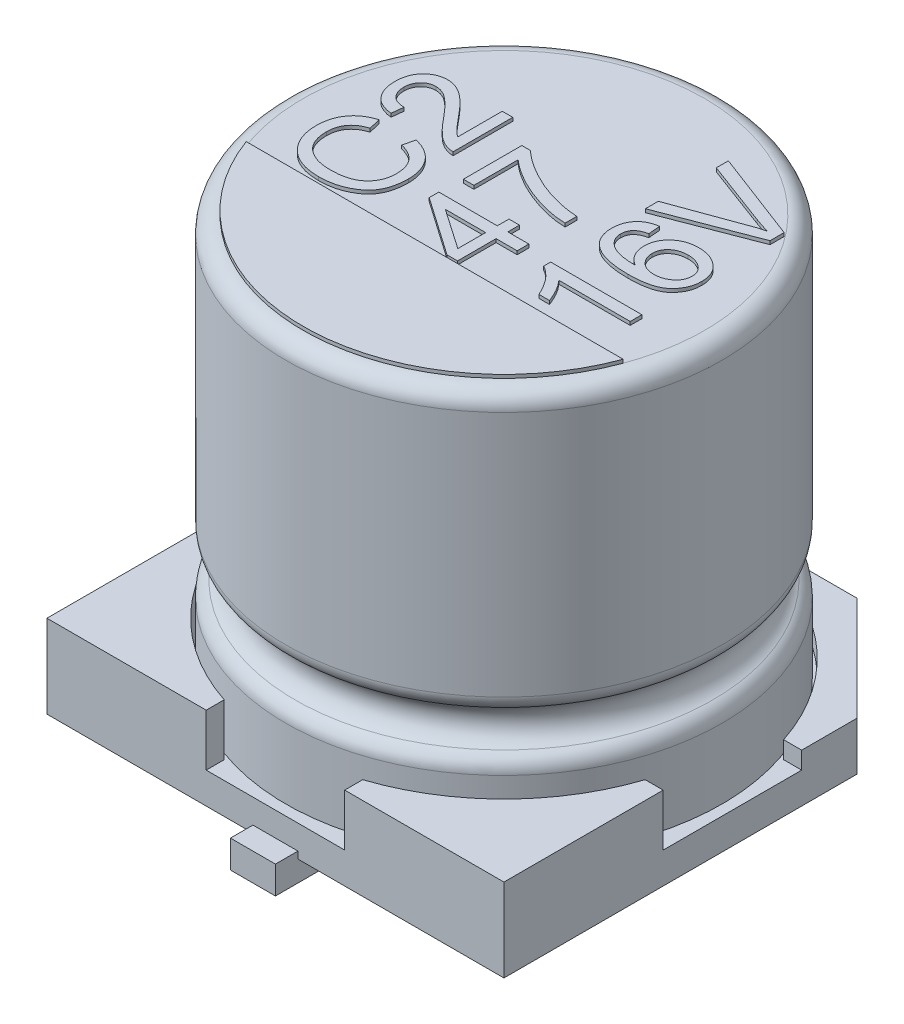
from build123d import *

# Parameters (mm, degrees)
ESQUISSE1_W               = 6.6
ESQUISSE1_H               = 6.6
BOSS_EXTRU_1_DEPTH        = 1.2
ESQUISSE2_R               = 3.2
ESQUISSE2_W               = 6.6
ESQUISSE2_H               = 2
ESQUISSE2_W_2             = 2
ESQUISSE2_H_2             = 6.6
ENL_V_MAT_EXTRU_1_DEPTH   = 0.75
ESQUISSE3_W               = 6.6
ESQUISSE3_H               = 3.3
ENL_V_MAT_EXTRU_2_DEPTH   = 0.5
CHANFREIN1_SIZE           = 1.5
BOSS_EXTRU_2_DEPTH        = 0.3
BOSS_EXTRU_2_DEPTH_BACK   = 0.1
ESQUISSE5_W               = 0.65
ESQUISSE5_H               = 0.65
BOSS_EXTRU_2_2_DEPTH      = 0.3
BOSS_EXTRU_2_2_DEPTH_BACK = 0.1
ESQUISSE6_R               = 0.5
BOSS_EXTRU_3_DEPTH        = 0.3
BOSS_EXTRU_4_DEPTH        = 0.05
BOSS_EXTRU_4_2_DEPTH      = 0.05
BOSS_EXTRU_4_3_DEPTH      = 0.05
BOSS_EXTRU_4_4_DEPTH      = 0.05
BOSS_EXTRU_4_5_DEPTH      = 0.05
BOSS_EXTRU_4_6_DEPTH      = 0.05
BOSS_EXTRU_4_7_DEPTH      = 0.05
BOSS_EXTRU_4_8_DEPTH      = 0.05


with BuildPart() as part:
    # Esquisse1 → Boss.-Extru.1 (new body)
    with BuildSketch(Plane(origin=(0, 0, 0), x_dir=(1, 0, 0), z_dir=(0, 1, 0))):
        Rectangle(ESQUISSE1_W, ESQUISSE1_H)
    extrude(amount=BOSS_EXTRU_1_DEPTH)

    # Esquisse2 → Enlèv. mat.-Extru.1 (cut)
    with BuildSketch(Plane(origin=(0, 1.2, 0), x_dir=(1, 0, 0), z_dir=(0, 1, 0))):
        Circle(ESQUISSE2_R)
        Rectangle(ESQUISSE2_W, ESQUISSE2_H)
        Rectangle(ESQUISSE2_W_2, ESQUISSE2_H_2)
    extrude(amount=-ENL_V_MAT_EXTRU_1_DEPTH, mode=Mode.SUBTRACT)

    # Esquisse3 → Enlèv. mat.-Extru.2 (cut)
    with BuildSketch(Plane(origin=(0, 1.2, 0), x_dir=(1, 0, 0), z_dir=(0, 1, 0))):
        with Locations((0, 1.65)):
            Rectangle(ESQUISSE3_W, ESQUISSE3_H)
    extrude(amount=-ENL_V_MAT_EXTRU_2_DEPTH, mode=Mode.SUBTRACT)

    # Chanfrein1
    chanfrein1_edges = [part.edges().sort_by_distance(p)[0] for p in [
        (3.3, 0.35, -3.3),
        (-3.3, 0.35, -3.3),
    ]]
    chamfer(chanfrein1_edges, length=CHANFREIN1_SIZE)

    # Esquisse6 → Boss.-Extru.3 (add)
    with BuildSketch(Plane.XZ):
        with Locations(Location((-2, 2, 0), (0, 0, 270))):
            Circle(ESQUISSE6_R)
        with Locations(Location((2, 2, 0), (0, 0, 270))):
            Circle(ESQUISSE6_R)
        with Locations(Location((2, -2, 0), (0, 0, 270))):
            Circle(ESQUISSE6_R)
        with Locations(Location((-2, -2, 0), (0, 0, 270))):
            Circle(ESQUISSE6_R)
    extrude(amount=BOSS_EXTRU_3_DEPTH)


with BuildPart() as body_2:
    # Esquisse4 → Révolution1 (revolve)
    with BuildSketch(Plane(origin=(0, 0, 0), x_dir=(0, 0, -1), z_dir=(1, 0, 0)), mode=Mode.PRIVATE) as r_volution1_sk:
        with BuildLine():
            Line((0, 6.25), (-2.9, 6.25))
            ThreePointArc((-2.9, 6.25), (-3.076776695, 6.176776695), (-3.15, 6))
            Line((-3.15, 6), (-3.15, 2.439897949))
            ThreePointArc((-3.15, 2.439897949), (-3.113200716, 2.309339707), (-3.013636364, 2.217217063))
            ThreePointArc((-3.013636364, 2.217217063), (-2.85, 1.95), (-3.013636364, 1.682782937))
            ThreePointArc((-3.013636364, 1.682782937), (-3.113200716, 1.590660293), (-3.15, 1.460102051))
            Line((-3.15, 1.460102051), (-3.15, 0.45))
            Line((-3.15, 0.45), (0, 0.45))
            Line((0, 0.45), (0, 6.25))
        make_face()
    revolve(r_volution1_sk.sketch.rotate(Axis((0, 0.45, 0), (0, 1, 0)), 180), axis=Axis((0, 0.45, 0), (0, 1, 0)))


with BuildPart() as body_3:
    # Esquisse5 → Boss.-Extru.2 (new, two sides: drawn at the far end of the back side and taken through both)
    with BuildSketch(Plane.XZ.offset(-BOSS_EXTRU_2_DEPTH_BACK)):
        with Locations((0, 3.3)):
            Rectangle(ESQUISSE5_W, ESQUISSE5_H)
    extrude(amount=BOSS_EXTRU_2_DEPTH + BOSS_EXTRU_2_DEPTH_BACK)


with BuildPart() as body_4:
    # Esquisse5 → Boss.-Extru.2 2 (new, two sides: drawn at the far end of the back side and taken through both)
    with BuildSketch(Plane.XZ.offset(-BOSS_EXTRU_2_2_DEPTH_BACK)):
        with Locations((0, -3.3)):
            Rectangle(ESQUISSE5_W, ESQUISSE5_H)
    extrude(amount=BOSS_EXTRU_2_2_DEPTH + BOSS_EXTRU_2_2_DEPTH_BACK)


with BuildPart() as body_5:
    # Esquisse7 → Boss.-Extru.4 (new body)
    with BuildSketch(Plane(origin=(0, 6.25, 0), x_dir=(1, 0, 0), z_dir=(0, 1, 0))):
        with BuildLine():
            Line((-2.722131518, -1), (2.722131518, -1))
            ThreePointArc((2.722131518, -1), (0, -2.9), (-2.722131518, -1))
        make_face()
    extrude(amount=BOSS_EXTRU_4_DEPTH)


with BuildPart() as body_6:
    # Esquisse7 → Boss.-Extru.4 2 (new body)
    with BuildSketch(Plane(origin=(0, 6.25, 0), x_dir=(1, 0, 0), z_dir=(0, 1, 0))):
        Polygon((0.296103896, -0.071428571), (0.296103896, -0.24025974), (0.6, -0.24025974), (0.6, -0.409090909), (0.296103896, -0.409090909), (0.296103896, -0.966233766), (0.144155844, -0.966233766), (-0.7, -0.379017857), (-0.7, -0.24025974), (0.144155844, -0.24025974), (0.144155844, -0.071428571), align=None)
        Polygon((0.144155844, -0.409090909), (-0.432508117, -0.409090909), (-0.432508117, -0.412520292), (0.144155844, -0.810064935), align=None, mode=Mode.SUBTRACT)
    extrude(amount=BOSS_EXTRU_4_2_DEPTH)


with BuildPart() as body_7:
    # Esquisse7 → Boss.-Extru.4 3 (new body)
    with BuildSketch(Plane(origin=(0, 6.25, 0), x_dir=(1, 0, 0), z_dir=(0, 1, 0))):
        with BuildLine():
            add(Edge.make_bspline(
                [(-0.561769481, 0.941558442), (-0.543990179, 0.925717685), (-0.508027109, 0.893675804), (-0.450586487, 0.848641711), (-0.3904709, 0.80453927), (-0.326676072, 0.762899908), (-0.260252054, 0.721970855), (-0.19025817, 0.683445144), (-0.117295293, 0.646115762), (-0.041643658, 0.610664543), (0.036098502, 0.578196899), (0.11472146, 0.548637502), (0.194253592, 0.523543832), (0.274149315, 0.50138235), (0.354781461, 0.483647136), (0.435863592, 0.46891175), (0.517682436, 0.458379626), (0.572543391, 0.454093271), (0.6, 0.451948052)],
                knots=[0, 0, 0, 0, 0.890443169, 1.8011434, 2.72871408, 3.67830878, 4.649628621, 5.64630914, 6.665648346, 7.714738694, 8.77023317, 9.816117091, 10.855215011, 11.888472104, 12.916223604, 13.941999776, 14.970019627, 16, 16, 16, 16], degree=3))
            Line((0.6, 0.451948052), (0.6, 0.283116883))
            add(Edge.make_bspline(
                [(0.6, 0.283116883), (0.577563575, 0.284043261), (0.531991638, 0.285924881), (0.462851153, 0.292875252), (0.392095355, 0.303794478), (0.319788097, 0.318428905), (0.245841613, 0.336366822), (0.170220452, 0.35803723), (0.093079903, 0.383812161), (0.014824341, 0.412421512), (-0.06269314, 0.44439909), (-0.138070487, 0.478962459), (-0.210847697, 0.515514293), (-0.280520376, 0.554995133), (-0.34760432, 0.59655633), (-0.411639883, 0.640745749), (-0.473239776, 0.686727654), (-0.51191236, 0.719836812), (-0.531168831, 0.736323052)],
                knots=[0, 0, 0, 0, 0.869045849, 1.765169938, 2.687948117, 3.639137891, 4.619848113, 5.632498604, 6.682982998, 7.767344363, 8.85702895, 9.927714978, 10.976477627, 12.008263417, 13.026390201, 14.029951021, 15.01904175, 16, 16, 16, 16], degree=3))
            Line((-0.531168831, 0.736323052), (-0.531168831, 0.097402597))
            Line((-0.531168831, 0.097402597), (-0.683116883, 0.097402597))
            Line((-0.683116883, 0.097402597), (-0.683116883, 0.941558442))
            Line((-0.683116883, 0.941558442), (-0.561769481, 0.941558442))
        make_face()
    extrude(amount=BOSS_EXTRU_4_3_DEPTH)


with BuildPart() as body_8:
    # Esquisse7 → Boss.-Extru.4 4 (new body)
    with BuildSketch(Plane(origin=(0, 6.25, 0), x_dir=(1, 0, 0), z_dir=(0, 1, 0))):
        with BuildLine():
            Line((2.3, -0.307792208), (2.3, -0.476623377))
            Line((2.3, -0.476623377), (1.27012987, -0.476623377))
            add(Edge.make_bspline(
                [(1.27012987, -0.476623377), (1.279223462, -0.486984406), (1.297670325, -0.508002338), (1.323418107, -0.541939461), (1.348324339, -0.578158837), (1.372037178, -0.617024985), (1.39472956, -0.658496452), (1.416257396, -0.702559652), (1.436916947, -0.748996188), (1.449463122, -0.781083079), (1.455844156, -0.797402597)],
                knots=[0, 0, 0, 0, 0.887204464, 1.799744156, 2.740245044, 3.715929421, 4.729246756, 5.78238396, 6.872111789, 8, 8, 8, 8], degree=3))
            Line((1.455844156, -0.797402597), (1.303896104, -0.797402597))
            add(Edge.make_bspline(
                [(1.303896104, -0.797402597), (1.293102344, -0.774483614), (1.272072929, -0.729830701), (1.236626461, -0.66705158), (1.199399203, -0.609831301), (1.16045468, -0.558087831), (1.119141498, -0.512270563), (1.076102522, -0.471980489), (1.031133268, -0.437074324), (0.998988334, -0.418340614), (0.983116883, -0.409090909)],
                knots=[0, 0, 0, 0, 1.186218497, 2.3111021, 3.37345738, 4.381680583, 5.341076965, 6.258983301, 7.14037897, 8, 8, 8, 8], degree=3))
            Line((0.983116883, -0.409090909), (0.983116883, -0.307792208))
            Line((0.983116883, -0.307792208), (2.3, -0.307792208))
        make_face()
    extrude(amount=BOSS_EXTRU_4_4_DEPTH)


with BuildPart() as body_9:
    # Esquisse7 → Boss.-Extru.4 5 (new body)
    with BuildSketch(Plane(origin=(0, 6.25, 0), x_dir=(1, 0, 0), z_dir=(0, 1, 0))):
        with BuildLine():
            add(Edge.make_bspline(
                [(1.627049513, 0.266233766), (1.613450204, 0.275238165), (1.586906324, 0.292813447), (1.551847818, 0.323932831), (1.52224805, 0.358062815), (1.497757448, 0.394853213), (1.478733011, 0.434622693), (1.465738061, 0.47733157), (1.457178022, 0.522656734), (1.456294986, 0.5539099), (1.455844156, 0.569866071)],
                knots=[0, 0, 0, 0, 1.069954415, 2.088395883, 3.066632478, 4.029065089, 4.982046927, 5.949919737, 6.953340264, 8, 8, 8, 8], degree=3))
            add(Edge.make_bspline(
                [(1.455844156, 0.569866071), (1.456191805, 0.582548179), (1.456878439, 0.607596362), (1.462545816, 0.64439928), (1.471850024, 0.679631672), (1.484485531, 0.713546338), (1.501385133, 0.7457272), (1.521383712, 0.776893214), (1.545647627, 0.806087597), (1.57293232, 0.833726618), (1.603149516, 0.858887064), (1.63558394, 0.88126992), (1.670435777, 0.899630894), (1.70699582, 0.915123616), (1.745722852, 0.927004517), (1.786547903, 0.935275404), (1.829318218, 0.940838077), (1.858558723, 0.941315506), (1.8734375, 0.941558442)],
                knots=[0, 0, 0, 0, 0.975125205, 1.925950693, 2.856152245, 3.774449697, 4.70315003, 5.646803566, 6.617626571, 7.617215937, 8.630442275, 9.637872749, 10.642483832, 11.65496491, 12.688309326, 13.752171127, 14.856211817, 16, 16, 16, 16], degree=3))
            add(Edge.make_bspline(
                [(1.8734375, 0.941558442), (1.888580343, 0.941317494), (1.918347182, 0.940843855), (1.961983437, 0.935238168), (2.004065218, 0.926985596), (2.04426656, 0.91475994), (2.082960891, 0.899469991), (2.119576045, 0.880323032), (2.154744008, 0.858075663), (2.187621145, 0.832380443), (2.218017881, 0.804115367), (2.244524958, 0.773169631), (2.26683893, 0.739924589), (2.285202716, 0.704550145), (2.299579764, 0.666870265), (2.309430036, 0.626812278), (2.315698497, 0.584571905), (2.316482257, 0.55564374), (2.316883117, 0.540848214)],
                knots=[0, 0, 0, 0, 1.085548404, 2.133902048, 3.150719742, 4.158438961, 5.143478499, 6.130857801, 7.117733313, 8.124563847, 9.119649328, 10.090449915, 11.040371519, 11.985443394, 12.943683995, 13.925811242, 14.939140701, 16, 16, 16, 16], degree=3))
            add(Edge.make_bspline(
                [(2.316883117, 0.540848214), (2.316485003, 0.525789733), (2.315699126, 0.496064278), (2.30922735, 0.45227623), (2.298467941, 0.410260062), (2.283175096, 0.369999989), (2.263930883, 0.331398768), (2.240229667, 0.294431855), (2.212090634, 0.25937232), (2.185526962, 0.231697854), (2.16173043, 0.210909807), (2.141984459, 0.196313685), (2.12071524, 0.182321071), (2.097548676, 0.169925454), (2.072879154, 0.158124335), (2.046428775, 0.147771295), (2.018546469, 0.137838126), (1.988771702, 0.129565645), (1.957480451, 0.121857064), (1.924464164, 0.115322522), (1.889799343, 0.10974132), (1.853435335, 0.105427189), (1.815463748, 0.101534382), (1.775761166, 0.099407309), (1.734430917, 0.09766443), (1.70627918, 0.09749094), (1.691943994, 0.097402597)],
                knots=[0, 0, 0, 0, 1.247779403, 2.463117631, 3.659976664, 4.836419457, 6.026221779, 7.229279442, 8.468942427, 9.747322861, 10.403533791, 11.085784176, 11.78126166, 12.511907243, 13.26182283, 14.046870347, 14.865219006, 15.714252586, 16.607026578, 17.536193268, 18.503241106, 19.516724355, 20.571286828, 21.666600567, 22.811806305, 24, 24, 24, 24], degree=3))
            add(Edge.make_bspline(
                [(1.691943994, 0.097402597), (1.66405944, 0.097732004), (1.610078492, 0.098369693), (1.53179155, 0.103971256), (1.45884114, 0.113044828), (1.391205321, 0.125820084), (1.328908012, 0.142369357), (1.271919877, 0.16260206), (1.220163171, 0.186578768), (1.173754642, 0.214256842), (1.132735067, 0.245565842), (1.097145189, 0.280237509), (1.066919268, 0.318271077), (1.042563218, 0.359827163), (1.02338332, 0.404577389), (1.009730122, 0.452607049), (1.001342979, 0.503973819), (1.000455589, 0.53932045), (1, 0.557467532)],
                knots=[0, 0, 0, 0, 1.424582619, 2.757810733, 4.007769843, 5.178820556, 6.271924257, 7.297969076, 8.264779121, 9.181696118, 10.053356541, 10.895296698, 11.714155951, 12.52784682, 13.349044585, 14.195146158, 15.073381762, 16, 16, 16, 16], degree=3))
            add(Edge.make_bspline(
                [(1, 0.557467532), (1.000266189, 0.569347725), (1.000788053, 0.592638937), (1.004513002, 0.626879674), (1.010823326, 0.659713581), (1.019796421, 0.691242231), (1.031438305, 0.721314076), (1.045468679, 0.750058478), (1.062151749, 0.777202626), (1.081137312, 0.802951217), (1.10276139, 0.826674161), (1.1269229, 0.848246212), (1.153717516, 0.867207906), (1.182816476, 0.883930992), (1.2145108, 0.897931697), (1.248615786, 0.909424797), (1.285095392, 0.918837371), (1.310447816, 0.922699565), (1.323417208, 0.924675325)],
                knots=[0, 0, 0, 0, 1.05367056, 2.065729412, 3.050830916, 4.016126385, 4.969213069, 5.907536784, 6.849258065, 7.791463712, 8.741097404, 9.691307467, 10.658743283, 11.647450802, 12.663499054, 13.726567437, 14.836993312, 16, 16, 16, 16], degree=3))
            Line((1.323417208, 0.924675325), (1.337662338, 0.755844156))
            add(Edge.make_bspline(
                [(1.337662338, 0.755844156), (1.321728395, 0.75208586), (1.291447841, 0.744943667), (1.249723652, 0.728902171), (1.214342308, 0.708544848), (1.185174599, 0.684021814), (1.162541528, 0.655279008), (1.14637255, 0.622526032), (1.136698364, 0.585712537), (1.135622605, 0.559813809), (1.135064935, 0.546387987)],
                knots=[0, 0, 0, 0, 1.226492651, 2.330802743, 3.33829511, 4.273637758, 5.170477757, 6.060897429, 6.994775133, 8, 8, 8, 8], degree=3))
            add(Edge.make_bspline(
                [(1.135064935, 0.546387987), (1.135418359, 0.536865112), (1.13612146, 0.517920305), (1.141813944, 0.490115874), (1.15120395, 0.463353983), (1.164247094, 0.437644759), (1.181017926, 0.412855033), (1.201917031, 0.389479109), (1.225918202, 0.366662204), (1.253763855, 0.345234113), (1.285645474, 0.325567517), (1.321890842, 0.308436717), (1.362583263, 0.294435138), (1.40723256, 0.282445887), (1.456249779, 0.27378698), (1.509334201, 0.26718345), (1.566755969, 0.26323262), (1.606466954, 0.262776826), (1.627049513, 0.262540584)],
                knots=[0, 0, 0, 0, 0.724409215, 1.441139678, 2.150297782, 2.877700373, 3.629574527, 4.421695389, 5.259767472, 6.14740045, 7.091057935, 8.106037173, 9.192047824, 10.362655148, 11.621681866, 12.977431459, 14.433375649, 16, 16, 16, 16], degree=3))
            Line((1.627049513, 0.262540584), (1.627049513, 0.266233766))
        make_face()
        with BuildLine():
            add(Edge.make_bspline(
                [(2.181818182, 0.536099838), (2.181568318, 0.544730718), (2.181078587, 0.561647203), (2.177124181, 0.586405497), (2.170111881, 0.609693653), (2.160894294, 0.631944567), (2.148641556, 0.652804154), (2.133757323, 0.672448191), (2.116205223, 0.690740401), (2.096179435, 0.707446087), (2.074354581, 0.722675103), (2.051171698, 0.736142616), (2.02680406, 0.74752572), (2.001378748, 0.756771669), (1.974821002, 0.763969329), (1.947084994, 0.768811814), (1.918276627, 0.77216642), (1.898684144, 0.772538422), (1.888737825, 0.772727273)],
                knots=[0, 0, 0, 0, 0.985621802, 1.931814126, 2.853484768, 3.758252722, 4.676468835, 5.608588604, 6.5676484, 7.56562942, 8.582686171, 9.604295749, 10.624324039, 11.65066286, 12.691060434, 13.762839569, 14.864283136, 16, 16, 16, 16], degree=3))
            add(Edge.make_bspline(
                [(1.888737825, 0.772727273), (1.878791822, 0.772538292), (1.859287392, 0.772167695), (1.830818773, 0.76886745), (1.803625762, 0.763924886), (1.77774465, 0.75681719), (1.753100396, 0.747564027), (1.729761047, 0.73619713), (1.707854683, 0.722641789), (1.687250682, 0.70743414), (1.668584593, 0.690451128), (1.652408352, 0.671792765), (1.638410137, 0.651947387), (1.627512427, 0.63030834), (1.618191522, 0.60759186), (1.612402747, 0.583107837), (1.608551277, 0.55741421), (1.608048678, 0.539808054), (1.607792208, 0.530823864)],
                knots=[0, 0, 0, 0, 1.146383952, 2.248095505, 3.300025281, 4.330631945, 5.338088421, 6.331106039, 7.318778256, 8.304262475, 9.280208679, 10.221574778, 11.146861143, 12.071925297, 13.009516616, 13.970978403, 14.964616916, 16, 16, 16, 16], degree=3))
            add(Edge.make_bspline(
                [(1.607792208, 0.530823864), (1.607939363, 0.522541124), (1.608230522, 0.506152986), (1.612236929, 0.482077137), (1.617844731, 0.458763298), (1.626262155, 0.436375771), (1.636613389, 0.414751193), (1.649943308, 0.394347961), (1.664828806, 0.374353159), (1.682526243, 0.355882187), (1.701818666, 0.338759636), (1.722905284, 0.323875968), (1.745387123, 0.311119324), (1.769547778, 0.300788247), (1.795238644, 0.292988165), (1.822303769, 0.287105465), (1.850836163, 0.283644735), (1.870350413, 0.283295088), (1.880296266, 0.283116883)],
                knots=[0, 0, 0, 0, 0.964721787, 1.908788045, 2.83888565, 3.756980023, 4.692487839, 5.628332754, 6.594252615, 7.595238226, 8.60516442, 9.598082325, 10.599015417, 11.614185319, 12.655278625, 13.72520881, 14.840604126, 16, 16, 16, 16], degree=3))
            add(Edge.make_bspline(
                [(1.880296266, 0.283116883), (1.890507691, 0.283286935), (1.910638719, 0.283622179), (1.940255727, 0.287255443), (1.968804316, 0.292626469), (1.99617096, 0.300626163), (2.022286204, 0.310915399), (2.047226077, 0.323430039), (2.071143302, 0.337956198), (2.093546616, 0.354775367), (2.114389341, 0.37294797), (2.132380715, 0.392825333), (2.147634985, 0.413865872), (2.160026551, 0.436123402), (2.169953686, 0.459427418), (2.176741364, 0.484003962), (2.181161479, 0.50964767), (2.181597232, 0.527199926), (2.181818182, 0.536099838)],
                knots=[0, 0, 0, 0, 1.117888879, 2.203830858, 3.263487087, 4.296727522, 5.321539455, 6.333737417, 7.349594489, 8.38207154, 9.398658853, 10.373700902, 11.311944705, 12.238999299, 13.158417895, 14.079197511, 15.026052622, 16, 16, 16, 16], degree=3))
        make_face(mode=Mode.SUBTRACT)
    extrude(amount=BOSS_EXTRU_4_5_DEPTH)


with BuildPart() as body_10:
    # Esquisse7 → Boss.-Extru.4 6 (new body)
    with BuildSketch(Plane(origin=(0, 6.25, 0), x_dir=(1, 0, 0), z_dir=(0, 1, 0))):
        with BuildLine():
            Line((1, 2.241558442), (2.3, 1.746672078))
            Line((2.3, 1.746672078), (2.3, 1.543019481))
            Line((2.3, 1.543019481), (1, 1.042857143))
            Line((1, 1.042857143), (1, 1.229362825))
            Line((1, 1.229362825), (1.943871753, 1.57362013))
            add(Edge.make_bspline(
                [(1.943871753, 1.57362013), (1.959566765, 1.579978572), (1.991939898, 1.593093737), (2.042890769, 1.611101638), (2.097947882, 1.62727369), (2.136063931, 1.637129747), (2.15570211, 1.642207792)],
                knots=[0, 0, 0, 0, 0.91165355, 1.880411525, 2.907944069, 4, 4, 4, 4], degree=3))
            Line((2.15570211, 1.642207792), (2.15570211, 1.645637175))
            add(Edge.make_bspline(
                [(2.15570211, 1.645637175), (2.120645079, 1.6552872), (2.049106452, 1.674979383), (1.979412596, 1.700446379), (1.943871753, 1.713433442)],
                knots=[0, 0, 0, 0, 0.980086758, 2, 2, 2, 2], degree=3))
            Line((1.943871753, 1.713433442), (1, 2.066396104))
            Line((1, 2.066396104), (1, 2.241558442))
        make_face()
    extrude(amount=BOSS_EXTRU_4_6_DEPTH)


with BuildPart() as body_11:
    # Esquisse7 → Boss.-Extru.4 7 (new body)
    with BuildSketch(Plane(origin=(0, 6.25, 0), x_dir=(1, 0, 0), z_dir=(0, 1, 0))):
        with BuildLine():
            add(Edge.make_bspline(
                [(-1.513592158, 0.249350649), (-1.4960214, 0.244303324), (-1.461759042, 0.234461218), (-1.412593327, 0.216155806), (-1.366938399, 0.19504078), (-1.324459979, 0.171453639), (-1.285908441, 0.144477896), (-1.250196964, 0.115632483), (-1.218483013, 0.083363689), (-1.18996861, 0.048846903), (-1.16487982, 0.012071485), (-1.143128862, -0.02657473), (-1.124942499, -0.067156877), (-1.109834773, -0.109380334), (-1.098268561, -0.153446835), (-1.089806823, -0.199192919), (-1.084682238, -0.246825133), (-1.08413979, -0.27920129), (-1.083864074, -0.295657468)],
                knots=[0, 0, 0, 0, 1.162857345, 2.267530702, 3.333896634, 4.360953501, 5.354188413, 6.324128997, 7.277551337, 8.227421396, 9.16936615, 10.106212879, 11.045228817, 11.99549423, 12.956291262, 13.940599034, 14.953246115, 16, 16, 16, 16], degree=3))
            add(Edge.make_bspline(
                [(-1.083864074, -0.295657468), (-1.084002268, -0.308939973), (-1.084274308, -0.335087004), (-1.086826309, -0.373528498), (-1.090264986, -0.410634922), (-1.096031592, -0.446228894), (-1.102637871, -0.480658158), (-1.111543704, -0.513589996), (-1.121390452, -0.545291267), (-1.133094184, -0.575484226), (-1.146254947, -0.604322156), (-1.161119728, -0.631722116), (-1.177140695, -0.658072753), (-1.195130913, -0.682711381), (-1.214446076, -0.706210022), (-1.235631759, -0.727957902), (-1.258079516, -0.748690809), (-1.290094437, -0.774217219), (-1.332659216, -0.802741768), (-1.386125027, -0.833064835), (-1.442164038, -0.858676189), (-1.500751997, -0.879635561), (-1.561953727, -0.895646543), (-1.625610685, -0.90724736), (-1.691765608, -0.914197528), (-1.736661347, -0.91511743), (-1.759452548, -0.915584416)],
                knots=[0, 0, 0, 0, 0.919048861, 1.809176737, 2.665355953, 3.496739813, 4.303484252, 5.090196945, 5.856160975, 6.599753386, 7.329497334, 8.048274368, 8.75588838, 9.461878281, 10.1576449, 10.859135909, 11.561154594, 12.271067417, 13.690501802, 15.101956996, 16.520647685, 17.948820654, 19.402690566, 20.893468995, 22.422977939, 24, 24, 24, 24], degree=3))
            add(Edge.make_bspline(
                [(-1.759452548, -0.915584416), (-1.784537126, -0.915126183), (-1.833440067, -0.91423285), (-1.90466678, -0.905892563), (-1.971729467, -0.892348942), (-2.034528653, -0.873014532), (-2.093257336, -0.848521581), (-2.147723222, -0.818204154), (-2.198036061, -0.782539237), (-2.243743536, -0.741513044), (-2.284344718, -0.696165733), (-2.320468185, -0.64779865), (-2.350184818, -0.595702833), (-2.374914779, -0.540782598), (-2.394262083, -0.482729019), (-2.407841323, -0.421561732), (-2.416272222, -0.357270765), (-2.41717088, -0.313358613), (-2.417630307, -0.290909091)],
                knots=[0, 0, 0, 0, 1.17572582, 2.292103567, 3.356980097, 4.379388748, 5.367919477, 6.334990253, 7.295924977, 8.253572839, 9.20815403, 10.145711904, 11.078462153, 12.014059973, 12.965796811, 13.941999351, 14.947873673, 16, 16, 16, 16], degree=3))
            add(Edge.make_bspline(
                [(-2.417630307, -0.290909091), (-2.41731238, -0.275071277), (-2.416687586, -0.243946738), (-2.412170958, -0.198086096), (-2.40449008, -0.154027319), (-2.394060115, -0.111624336), (-2.380156591, -0.071126775), (-2.363672815, -0.032181121), (-2.343631931, 0.004814832), (-2.321174134, 0.040292183), (-2.295123554, 0.073195167), (-2.266638951, 0.104011973), (-2.235069724, 0.132061229), (-2.200668282, 0.157399044), (-2.163472827, 0.180170198), (-2.123544472, 0.200502773), (-2.080766535, 0.218263422), (-2.050853453, 0.227680961), (-2.035649788, 0.232467532)],
                knots=[0, 0, 0, 0, 1.084719424, 2.13169519, 3.152567876, 4.145885688, 5.119153041, 6.082398705, 7.038974436, 7.997955175, 8.954606747, 9.909189511, 10.869020972, 11.84234423, 12.831930089, 13.852802775, 14.90866256, 16, 16, 16, 16], degree=3))
            Line((-2.035649788, 0.232467532), (-1.995552385, 0.063636364))
            add(Edge.make_bspline(
                [(-1.995552385, 0.063636364), (-2.006509836, 0.059820642), (-2.027883688, 0.052377608), (-2.058458961, 0.039040776), (-2.086922234, 0.0243156), (-2.113384187, 0.00820755), (-2.137828041, -0.009214092), (-2.160090295, -0.028267501), (-2.180155654, -0.048895982), (-2.198164528, -0.070865341), (-2.214166073, -0.094199264), (-2.227765961, -0.11913751), (-2.239811836, -0.145210726), (-2.249219317, -0.172832666), (-2.256672967, -0.201754028), (-2.261853498, -0.232107359), (-2.265115879, -0.263930132), (-2.265490695, -0.285624931), (-2.265682255, -0.296712662)],
                knots=[0, 0, 0, 0, 1.144066344, 2.231641889, 3.286745147, 4.302659249, 5.284651632, 6.244173363, 7.188683126, 8.119273077, 9.043007686, 9.974688197, 10.917843137, 11.872334576, 12.848372524, 13.860726428, 14.906664664, 16, 16, 16, 16], degree=3))
            add(Edge.make_bspline(
                [(-2.265682255, -0.296712662), (-2.265291886, -0.314581072), (-2.264531624, -0.349380693), (-2.258212981, -0.399946073), (-2.247375311, -0.447218149), (-2.232403077, -0.491236313), (-2.213072642, -0.531910595), (-2.189452791, -0.569149539), (-2.161446067, -0.602997999), (-2.1292281, -0.633328742), (-2.093180065, -0.659774043), (-2.054411938, -0.6832659), (-2.012662334, -0.702963581), (-1.967997746, -0.719202237), (-1.920341378, -0.731425176), (-1.86991137, -0.740390219), (-1.816546291, -0.745693444), (-1.780040899, -0.746393725), (-1.761299139, -0.746753247)],
                knots=[0, 0, 0, 0, 1.116887436, 2.175194062, 3.179398072, 4.144308485, 5.07628433, 5.988313003, 6.89424019, 7.815960346, 8.747271137, 9.684453683, 10.645975242, 11.62857767, 12.651331023, 13.717887571, 14.828370253, 16, 16, 16, 16], degree=3))
            add(Edge.make_bspline(
                [(-1.761299139, -0.746753247), (-1.739831712, -0.746415862), (-1.698227937, -0.745762012), (-1.637906274, -0.740252372), (-1.581804132, -0.73084142), (-1.530004561, -0.717697653), (-1.482339102, -0.701200524), (-1.438999096, -0.680598272), (-1.400053347, -0.655924078), (-1.365220913, -0.627888023), (-1.334983422, -0.596559679), (-1.308321773, -0.563173913), (-1.285718371, -0.527400303), (-1.267495082, -0.489093484), (-1.253152604, -0.44861818), (-1.243234477, -0.4057833), (-1.237019922, -0.360822054), (-1.236219781, -0.330059885), (-1.235812126, -0.314387175)],
                knots=[0, 0, 0, 0, 1.335001587, 2.587227048, 3.763267398, 4.869534239, 5.907361014, 6.89562929, 7.846964169, 8.768579182, 9.669714952, 10.54947023, 11.421953692, 12.295242416, 13.182597618, 14.087311047, 15.025523218, 16, 16, 16, 16], degree=3))
            add(Edge.make_bspline(
                [(-1.235812126, -0.314387175), (-1.236077835, -0.301540465), (-1.236597646, -0.276408303), (-1.240305017, -0.239535139), (-1.246591455, -0.204523337), (-1.255320311, -0.171350975), (-1.266353179, -0.140033512), (-1.280111907, -0.110591408), (-1.296574594, -0.083102075), (-1.315352098, -0.057295319), (-1.336849781, -0.033538991), (-1.360703344, -0.011575616), (-1.387011767, 0.008693618), (-1.416103094, 0.026748256), (-1.447591775, 0.043138752), (-1.481546005, 0.057655194), (-1.518028854, 0.070397132), (-1.543525492, 0.077089797), (-1.556591346, 0.080519481)],
                knots=[0, 0, 0, 0, 1.107397515, 2.166413932, 3.190899866, 4.170923074, 5.120390243, 6.049577835, 6.967409733, 7.878644088, 8.796507289, 9.724581045, 10.670683286, 11.655006723, 12.672174807, 13.728257053, 14.83583617, 16, 16, 16, 16], degree=3))
            Line((-1.556591346, 0.080519481), (-1.513592158, 0.249350649))
        make_face()
    extrude(amount=BOSS_EXTRU_4_7_DEPTH)


with BuildPart() as body_12:
    # Esquisse7 → Boss.-Extru.4 8 (new body)
    with BuildSketch(Plane(origin=(0, 6.25, 0), x_dir=(1, 0, 0), z_dir=(0, 1, 0))):
        with BuildLine():
            Line((-1.10074719, 1.228571429), (-1.10074719, 0.367532468))
            add(Edge.make_bspline(
                [(-1.10074719, 0.367532468), (-1.109812552, 0.367838169), (-1.128091673, 0.368454576), (-1.155581711, 0.37185773), (-1.183081129, 0.37804178), (-1.210668211, 0.386563068), (-1.238345997, 0.397413354), (-1.266193806, 0.410589569), (-1.293797307, 0.426686967), (-1.322257829, 0.444670471), (-1.35132615, 0.466494883), (-1.381797095, 0.492211734), (-1.41441685, 0.521719194), (-1.448186622, 0.556055866), (-1.484534211, 0.593882738), (-1.522000541, 0.636445856), (-1.561429065, 0.683020947), (-1.587955213, 0.715697204), (-1.601700924, 0.73262987)],
                knots=[0, 0, 0, 0, 0.6796431, 1.370411742, 2.07240806, 2.789555471, 3.532466849, 4.298947543, 5.095988285, 5.92599991, 6.82102785, 7.817621663, 8.914000656, 10.116368331, 11.426330088, 12.845554693, 14.365382899, 16, 16, 16, 16], degree=3))
            add(Edge.make_bspline(
                [(-1.601700924, 0.73262987), (-1.61887004, 0.753598853), (-1.652805771, 0.795045236), (-1.705675797, 0.854127484), (-1.760121904, 0.909080462), (-1.805978602, 0.95232677), (-1.843437043, 0.983677458), (-1.871309875, 1.004259596), (-1.899690996, 1.020978816), (-1.92773426, 1.035326567), (-1.956096421, 1.046041229), (-1.984359497, 1.054199706), (-2.01281693, 1.058724131), (-2.031766425, 1.059402783), (-2.041189561, 1.05974026)],
                knots=[0, 0, 0, 0, 1.727365886, 3.414236585, 5.051125997, 6.657366303, 7.42955054, 8.163886393, 8.862711004, 9.526964272, 10.169215867, 10.792073404, 11.3993267, 12, 12, 12, 12], degree=3))
            add(Edge.make_bspline(
                [(-2.041189561, 1.05974026), (-2.049115926, 1.059550364), (-2.06468221, 1.059177434), (-2.087547396, 1.055848481), (-2.109484946, 1.050795356), (-2.130121695, 1.042877612), (-2.149938766, 1.033511581), (-2.168327225, 1.021333672), (-2.186234903, 1.007779357), (-2.202378892, 0.991616094), (-2.217108647, 0.974034246), (-2.230074735, 0.955213877), (-2.24131492, 0.935346364), (-2.250260494, 0.914172562), (-2.257067531, 0.891866084), (-2.262149738, 0.868589348), (-2.265038382, 0.844113437), (-2.265464318, 0.827428943), (-2.265682255, 0.818892045)],
                knots=[0, 0, 0, 0, 1.031811344, 2.026334621, 3.004164389, 3.957265922, 4.899779801, 5.852881334, 6.82425049, 7.820421148, 8.820534449, 9.808573505, 10.793087995, 11.78866591, 12.795771953, 13.826883829, 14.888089174, 16, 16, 16, 16], degree=3))
            add(Edge.make_bspline(
                [(-2.265682255, 0.818892045), (-2.265465708, 0.810267015), (-2.2650424, 0.793406808), (-2.262122813, 0.768586833), (-2.257069858, 0.744868134), (-2.250259983, 0.722038675), (-2.241326559, 0.700335524), (-2.230019046, 0.679893056), (-2.217100247, 0.660362917), (-2.20247601, 0.641799628), (-2.185520917, 0.625183978), (-2.166622413, 0.610503583), (-2.14571863, 0.598085773), (-2.122741657, 0.588024146), (-2.097873515, 0.580186132), (-2.071133768, 0.57435252), (-2.042418886, 0.570956109), (-2.022644748, 0.570411202), (-2.012435502, 0.57012987)],
                knots=[0, 0, 0, 0, 1.031812441, 2.01698662, 2.984649478, 3.929806142, 4.863654442, 5.786355652, 6.720026173, 7.663072848, 8.607819605, 9.552624931, 10.519658563, 11.508756638, 12.546771345, 13.634199285, 14.778553981, 16, 16, 16, 16], degree=3))
            Line((-2.012435502, 0.57012987), (-2.030637613, 0.401298701))
            add(Edge.make_bspline(
                [(-2.030637613, 0.401298701), (-2.045181325, 0.402811718), (-2.073659774, 0.405774399), (-2.11481109, 0.414257583), (-2.153413885, 0.425886911), (-2.189279899, 0.440644489), (-2.222705511, 0.458316295), (-2.253066349, 0.479719551), (-2.281280934, 0.503642785), (-2.306322602, 0.530991206), (-2.328379882, 0.560827374), (-2.347748358, 0.592602421), (-2.364122012, 0.626266882), (-2.377731504, 0.661790572), (-2.387888994, 0.699389244), (-2.395244174, 0.73881804), (-2.399835034, 0.780181864), (-2.400438635, 0.80841597), (-2.40074719, 0.822849026)],
                knots=[0, 0, 0, 0, 1.121289774, 2.195628777, 3.217890541, 4.210126713, 5.166915201, 6.112001681, 7.054484082, 7.999787246, 8.949677246, 9.897264597, 10.850693622, 11.8179611, 12.811412054, 13.834207939, 14.892863877, 16, 16, 16, 16], degree=3))
            add(Edge.make_bspline(
                [(-2.40074719, 0.822849026), (-2.400491832, 0.838429256), (-2.399995558, 0.86870841), (-2.394749613, 0.912798703), (-2.386799133, 0.954350542), (-2.375145076, 0.993204355), (-2.360409218, 1.029460084), (-2.341962652, 1.062850748), (-2.320709265, 1.093969802), (-2.295745952, 1.121804886), (-2.268636884, 1.146671142), (-2.240249757, 1.168835227), (-2.210035053, 1.186960259), (-2.178926949, 1.202646735), (-2.14601932, 1.214015323), (-2.111988856, 1.222641851), (-2.076517549, 1.22773876), (-2.0523732, 1.228291329), (-2.040134366, 1.228571429)],
                knots=[0, 0, 0, 0, 1.226374278, 2.383378012, 3.491544918, 4.554095796, 5.572566929, 6.567339196, 7.552739974, 8.533800296, 9.504097501, 10.447305466, 11.364140806, 12.27462574, 13.185742444, 14.099381857, 15.036571671, 16, 16, 16, 16], degree=3))
            add(Edge.make_bspline(
                [(-2.040134366, 1.228571429), (-2.029744501, 1.228330947), (-2.008791916, 1.227845984), (-1.977359035, 1.223437408), (-1.94577076, 1.216278849), (-1.914154165, 1.206150089), (-1.882367429, 1.193479062), (-1.850633677, 1.177836107), (-1.818988012, 1.15915491), (-1.78642361, 1.137828784), (-1.752726044, 1.111837452), (-1.716535419, 1.081037521), (-1.678284227, 1.043924132), (-1.636397158, 1.002232144), (-1.592574166, 0.954147613), (-1.545502518, 0.900932577), (-1.496102554, 0.84182761), (-1.462614012, 0.800302815), (-1.445268294, 0.778794643)],
                knots=[0, 0, 0, 0, 0.647266628, 1.305301832, 1.974044492, 2.663877698, 3.372185328, 4.105022653, 4.866383139, 5.66134239, 6.529461504, 7.516814748, 8.621586341, 9.850038094, 11.1997065, 12.675225268, 14.2779005, 16, 16, 16, 16], degree=3))
            add(Edge.make_bspline(
                [(-1.445268294, 0.778794643), (-1.436109233, 0.767389994), (-1.418439067, 0.74538752), (-1.391619775, 0.714475151), (-1.366047991, 0.686220691), (-1.341700244, 0.660598603), (-1.318071603, 0.638009837), (-1.295485977, 0.618365809), (-1.274158275, 0.601106382), (-1.259630669, 0.591567036), (-1.252695242, 0.587012987)],
                knots=[0, 0, 0, 0, 1.28638092, 2.481756772, 3.598704207, 4.637980996, 5.589780294, 6.472288135, 7.270675925, 8, 8, 8, 8], degree=3))
            Line((-1.252695242, 0.587012987), (-1.252695242, 1.228571429))
            Line((-1.252695242, 1.228571429), (-1.10074719, 1.228571429))
        make_face()
    extrude(amount=BOSS_EXTRU_4_8_DEPTH)


solid = Compound([part.part, body_2.part, body_3.part, body_4.part, body_5.part, body_6.part, body_7.part, body_8.part, body_9.part, body_10.part, body_11.part, body_12.part])
